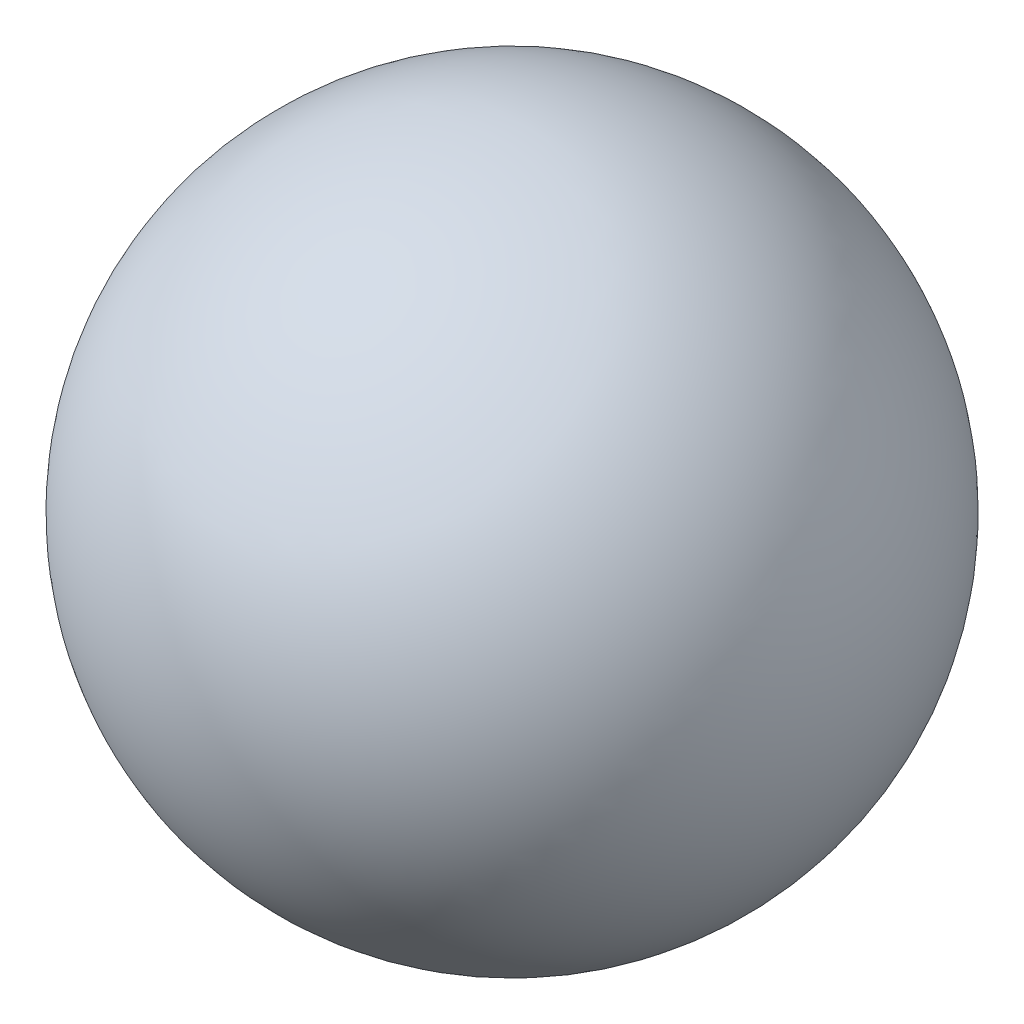
from build123d import *


with BuildPart() as part:
    # Esquisse1 → Révolution1 (revolve)
    with BuildSketch(Plane(origin=(0, 0, 0), x_dir=(1, 0, 0), z_dir=(0, 1, 0))):
        with BuildLine():
            Line((0, 32), (0, -32))
            ThreePointArc((0, -32), (32, 0), (0, 32))
        make_face()
    revolve(axis=Axis((0, 0, -32), (0, 0, 1)))


solid = part.part
